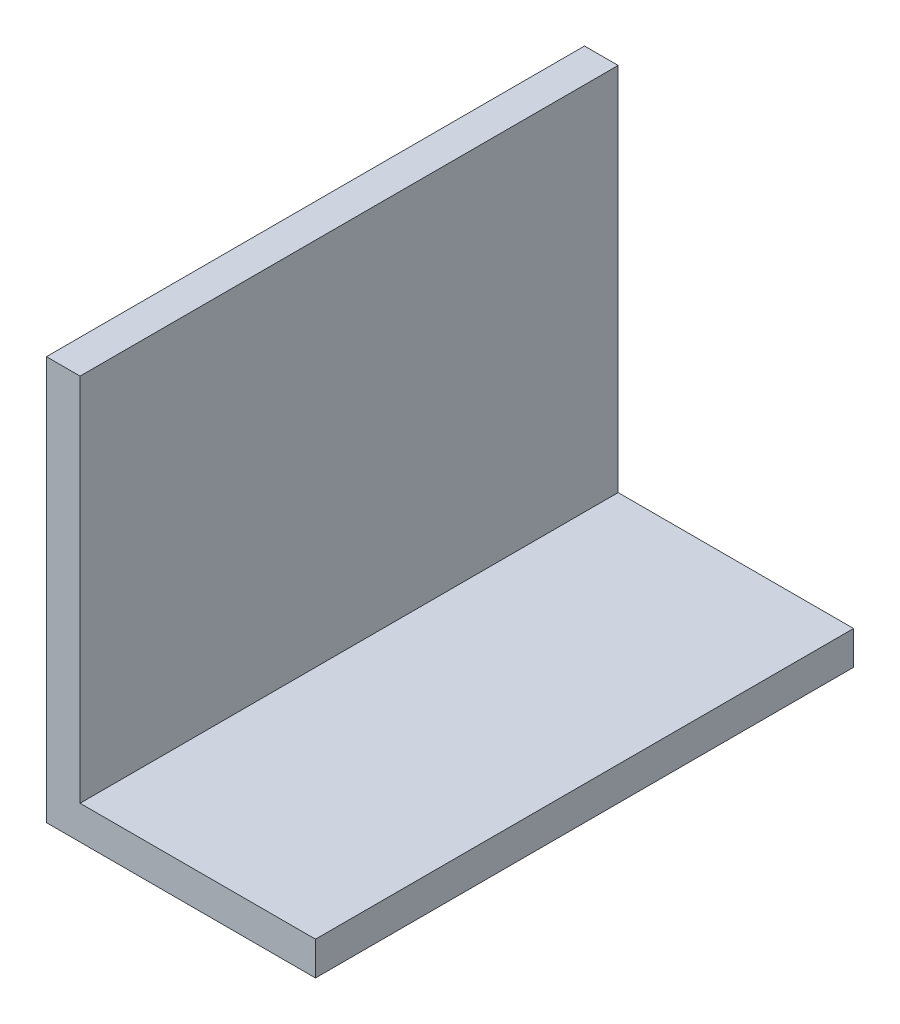
from build123d import *

# Parameters (mm, degrees)
EXTRUDE_THIN1_DEPTH = 50.8


with BuildPart() as part:
    # Sketch1 → Extrude-Thin1 (new body)
    with BuildSketch(Plane.XY):
        Polygon((25.4, 0), (0, 0), (0, 38.1), (3.175, 38.1), (3.175, 3.175), (25.4, 3.175), align=None)
    extrude(amount=EXTRUDE_THIN1_DEPTH)


solid = part.part
